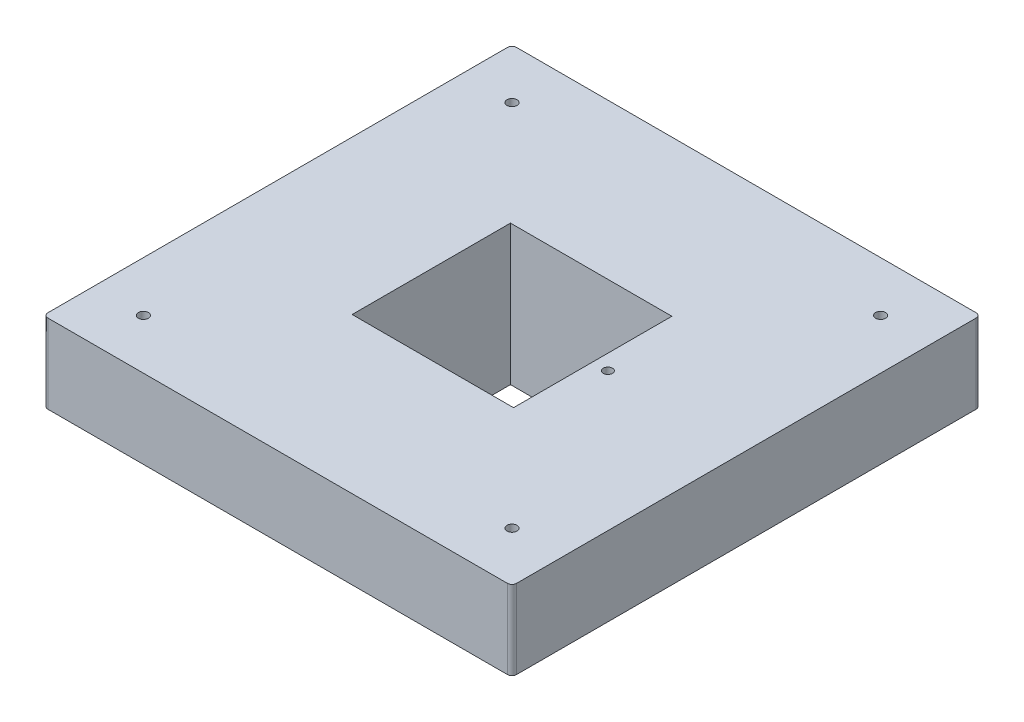
from build123d import *

# Parameters (mm, degrees)
SKETCH1_W                   = 153.92
SKETCH1_H                   = 153.92
SKETCH1_R                   = 1.5
SKETCH1_W_2                 = 53
SKETCH1_H_2                 = 52
BOSS_EXTRUDE1_DEPTH         = 25.95
TAP_DRILL_FOR_M4X0_7_TAP2_D = 3.3
SKETCH3_R                   = 55
SKETCH3_W                   = 53
SKETCH3_H                   = 52
BOSS_EXTRUDE3_DEPTH         = 20
SKETCH5_R                   = 3.225
CUT_EXTRUDE1_DEPTH          = 6.35
FILLET2_R                   = 1.5


with BuildPart() as part:
    # Sketch1 → Boss-Extrude1 (new body)
    with BuildSketch(Plane(origin=(0, 0, 0), x_dir=(1, 0, 0), z_dir=(0, 1, 0))):
        Rectangle(SKETCH1_W, SKETCH1_H)
        with Locations(Location((31.5, 0, 0), (0, 0, 270))):
            Circle(SKETCH1_R, mode=Mode.SUBTRACT)
        Rectangle(SKETCH1_W_2, SKETCH1_H_2, mode=Mode.SUBTRACT)
    extrude(amount=-BOSS_EXTRUDE1_DEPTH)

    # Tap Drill for M4x0.7 Tap2 (through all)
    with Locations(Plane(origin=(-60.5282, 0, -60.5282), x_dir=(0, 0, 1), z_dir=(0, 1, 0))):
        with Locations((0, 0), (121.0564, 0), (121.0564, 121.0564), (0, 121.0564)):
            Hole(TAP_DRILL_FOR_M4X0_7_TAP2_D / 2)

    # Sketch3 → Boss-Extrude3 (add)
    with BuildSketch(Plane.XZ.offset(25.95)):
        with Locations(Location((0, 0, 0), (0, 0, 90))):
            Circle(SKETCH3_R)
        Rectangle(SKETCH3_W, SKETCH3_H, mode=Mode.SUBTRACT)
    extrude(amount=BOSS_EXTRUDE3_DEPTH)

    # Sketch5 → Cut-Extrude1 (cut)
    with BuildSketch(Plane.XZ.offset(45.95)):
        with Locations(Location((-37.5, 0, 0), (0, 0, 270))):
            Circle(SKETCH5_R)
        with Locations(Location((37.5, 0, 0), (0, 0, 270))):
            Circle(SKETCH5_R)
    extrude(amount=-CUT_EXTRUDE1_DEPTH, mode=Mode.SUBTRACT)

    # Fillet2
    fillet2_edges = [part.edges().sort_by_distance(p)[0] for p in [
        (-76.96, -12.975, 76.96),
        (-76.96, -12.975, -76.96),
        (76.96, -12.975, -76.96),
        (76.96, -12.975, 76.96),
    ]]
    fillet(fillet2_edges, radius=FILLET2_R)


solid = part.part
